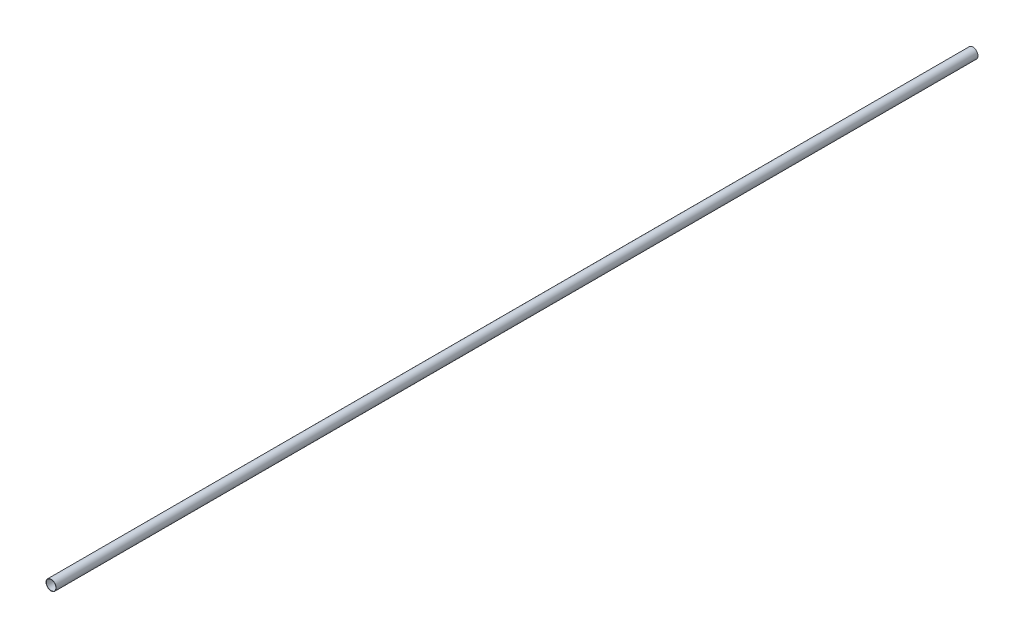
from build123d import *

# Parameters (mm, degrees)
SKETCH1_R           = 4.572
SKETCH1_R_2         = 4.318
BOSS_EXTRUDE1_DEPTH = 825.5


with BuildPart() as part:
    # Sketch1 → Boss-Extrude1 (new body)
    with BuildSketch(Plane.XY):
        with Locations((-113.00537488, -113.00537488)):
            Circle(SKETCH1_R)
        with Locations((-113.00537488, -113.00537488)):
            Circle(SKETCH1_R_2, mode=Mode.SUBTRACT)
    extrude(amount=BOSS_EXTRUDE1_DEPTH)


solid = part.part
